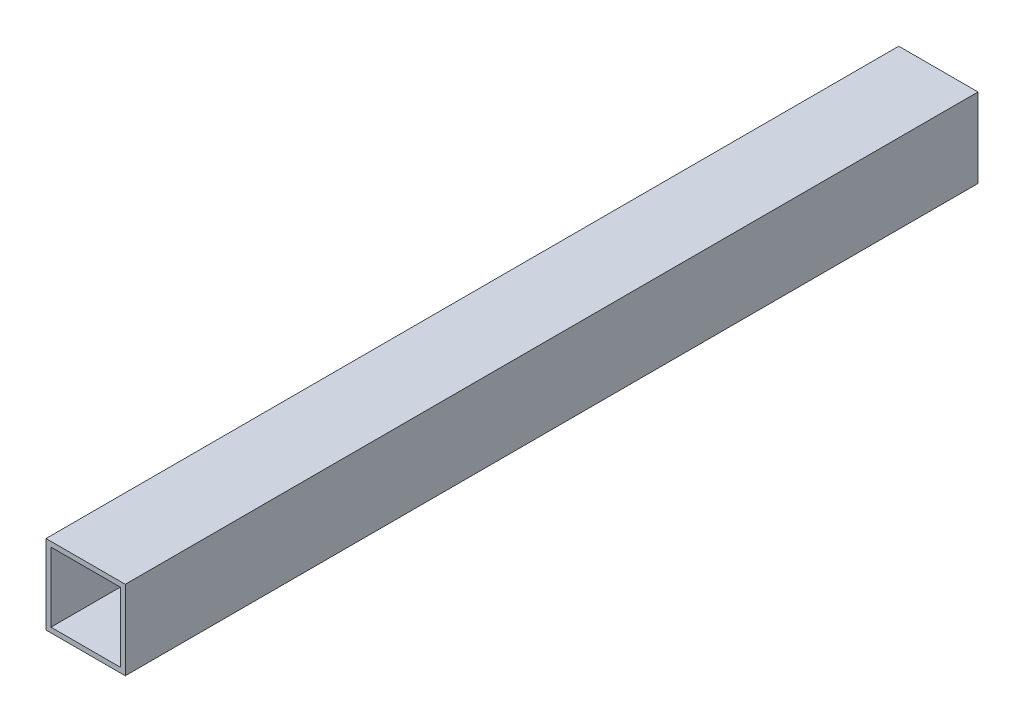
from build123d import *

# Parameters (mm, degrees)
SKETCH1_W           = 50.8
SKETCH1_H           = 50.8
SKETCH1_W_2         = 44.45
SKETCH1_H_2         = 44.45
BOSS_EXTRUDE2_DEPTH = 546.534467


with BuildPart() as part:
    # Sketch1 → Boss-Extrude2 (new body)
    with BuildSketch(Plane.XY):
        with Locations((7.14428995, -1.742176797)):
            Rectangle(SKETCH1_W, SKETCH1_H)
        with Locations((7.14428995, -1.742176797)):
            Rectangle(SKETCH1_W_2, SKETCH1_H_2, mode=Mode.SUBTRACT)
    extrude(amount=BOSS_EXTRUDE2_DEPTH)


solid = part.part
